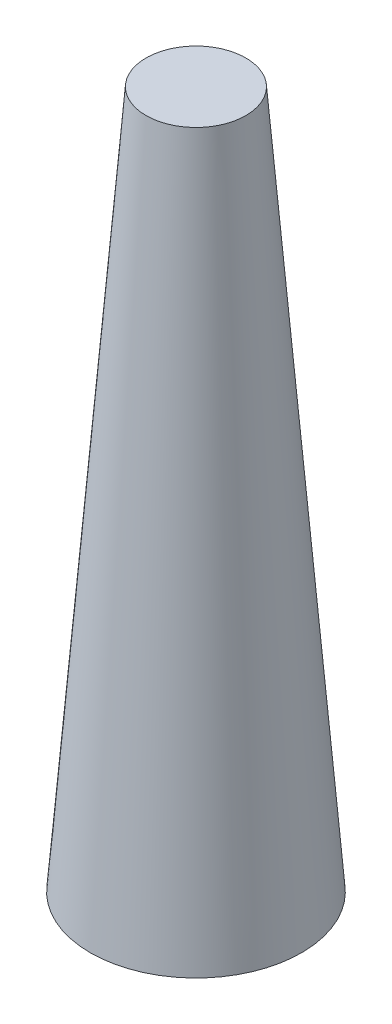
from build123d import *

# Parameters (mm, degrees)
SKETCH2_R = 1.20015
SKETCH1_R = 2.54


with BuildPart() as part:
    # Sketch2 → Loft1 section 0
    with BuildSketch(Plane(origin=(0, 16.764, 0), x_dir=(1, 0, 0), z_dir=(0, 1, 0))):
        Circle(SKETCH2_R)
    # Sketch1 → Loft1 section 1
    with BuildSketch(Plane(origin=(0, 0, 0), x_dir=(1, 0, 0), z_dir=(0, 1, 0))):
        Circle(SKETCH1_R)
    loft()


solid = part.part
